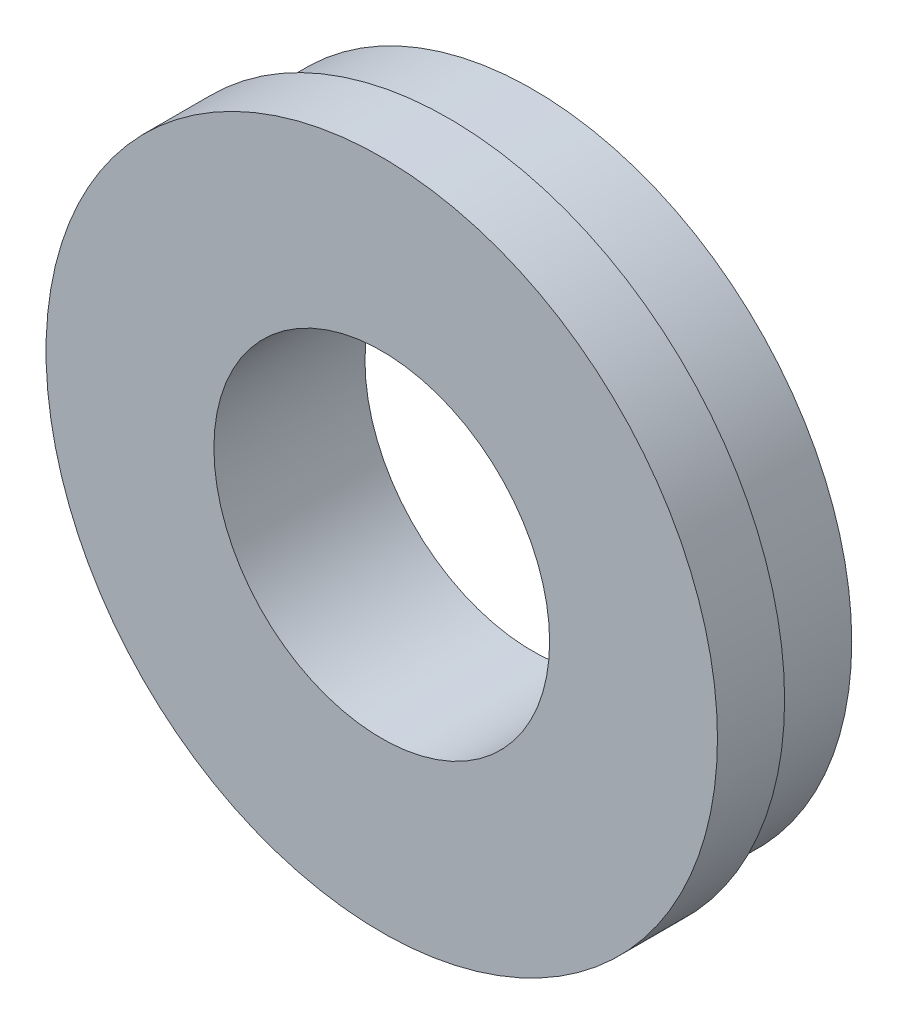
from build123d import *

# Parameters (mm, degrees)
SKETCH_2_W = 1.8
SKETCH_2_H = 2


with BuildPart() as part:
    # 草图1 → 旋转1 (revolve)
    with BuildSketch(Plane(origin=(0, 0, 0), x_dir=(0, 0, -1), z_dir=(1, 0, 0))):
        Polygon((0, 0), (0, 4), (0.8, 4), (0.8, 3.8), (1.8, 3.8), (1.8, 0), align=None)
    revolve(axis=Axis((0, 0, -1.8), (0, 0, 1)))

    # 草图2 → 切除-旋转1 (revolve, cut)
    with BuildSketch(Plane(origin=(0, 0, 0), x_dir=(0, 0, -1), z_dir=(1, 0, 0))):
        with Locations((0.9, 1)):
            Rectangle(SKETCH_2_W, SKETCH_2_H)
    revolve(axis=Axis((0, 0, -1.8), (0, 0, 1)), mode=Mode.SUBTRACT)


solid = part.part
